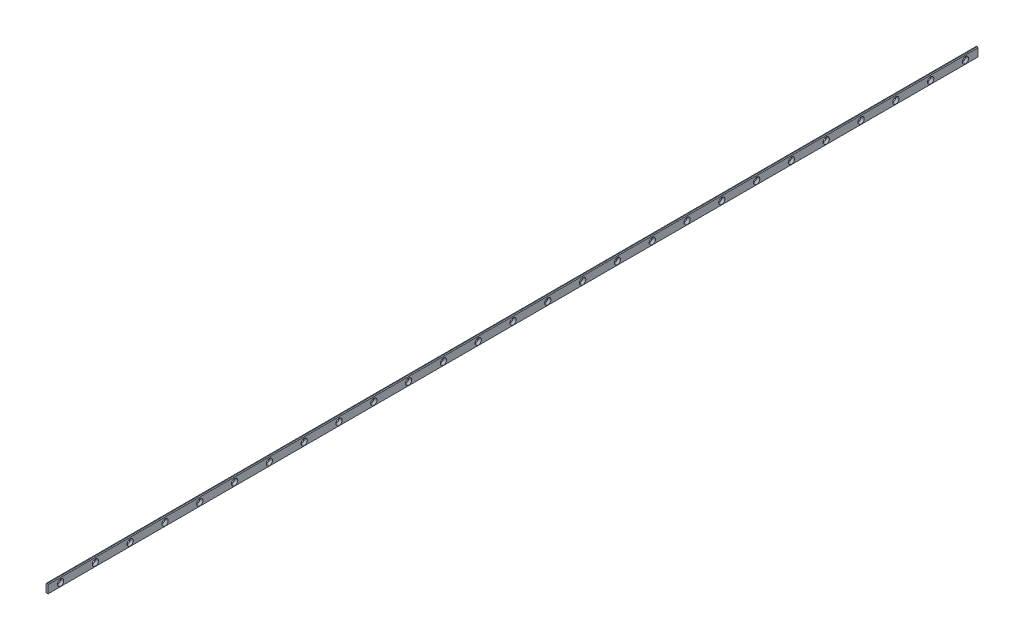
from build123d import *

# Parameters (mm, degrees)
SKETCH1_W                      = 3
SKETCH1_H                      = 12.5
BOSS_EXTRUDE1_DEPTH            = 668
SKETCH2_R                      = 2
CUT_EXTRUDE1_DEPTH             = 10
CHAMFER1_SIZE                  = 2.5
LPATTERN1_COUNT                = 14
LPATTERN1_PITCH                = 50
CHAMFER1_OF_LPATTERN1_SIZE     = 2.5
LPATTERN1_COL_COUNT            = 14
LPATTERN1_COL_PITCH            = 50
CHAMFER1_OF_LPATTERN1_COL_SIZE = 2.5
CHAMFER2_SIZE                  = 1


with BuildPart() as part:
    # Sketch1 → Boss-Extrude1 (new, symmetric)
    with BuildSketch(Plane.XY):
        Rectangle(SKETCH1_W, SKETCH1_H)
    extrude(amount=BOSS_EXTRUDE1_DEPTH, both=True)

    # Sketch2 → Cut-Extrude1 (cut)
    with BuildSketch(Plane(origin=(1.5, 0, 0), x_dir=(0, 0, -1), z_dir=(1, 0, 0))):
        with Locations((0, -1.25)):
            Circle(SKETCH2_R)
    cut_extrude1 = extrude(amount=-CUT_EXTRUDE1_DEPTH, mode=Mode.SUBTRACT)

    # Chamfer1
    chamfer1_edges = [part.edges().sort_by_distance(p)[0] for p in [
        (1.5, -1.25, 2),
    ]]
    chamfer(chamfer1_edges, length=CHAMFER1_SIZE)

    # LPattern1: Cut-Extrude1 ×14
    with Locations(*[(0, 0, i * LPATTERN1_PITCH) for i in range(1, LPATTERN1_COUNT)]):
        add(cut_extrude1, mode=Mode.SUBTRACT)

    # Chamfer1 of LPattern1
    chamfer1_of_lpattern1_edges = [part.edges().sort_by_distance(p)[0] for p in [
        (1.5, -1.25, 52),
        (1.5, -1.25, 102),
        (1.5, -1.25, 152),
        (1.5, -1.25, 202),
        (1.5, -1.25, 252),
        (1.5, -1.25, 302),
        (1.5, -1.25, 352),
        (1.5, -1.25, 402),
        (1.5, -1.25, 452),
        (1.5, -1.25, 502),
        (1.5, -1.25, 552),
        (1.5, -1.25, 602),
        (1.5, -1.25, 652),
    ]]
    chamfer(chamfer1_of_lpattern1_edges, length=CHAMFER1_OF_LPATTERN1_SIZE)

    # LPattern1 col: Cut-Extrude1 ×14
    with Locations(*[(0, 0, -i * LPATTERN1_COL_PITCH) for i in range(1, LPATTERN1_COL_COUNT)]):
        add(cut_extrude1, mode=Mode.SUBTRACT)

    # Chamfer1 of LPattern1 col
    chamfer1_of_lpattern1_col_edges = [part.edges().sort_by_distance(p)[0] for p in [
        (1.5, -1.25, -48),
        (1.5, -1.25, -98),
        (1.5, -1.25, -148),
        (1.5, -1.25, -198),
        (1.5, -1.25, -248),
        (1.5, -1.25, -298),
        (1.5, -1.25, -348),
        (1.5, -1.25, -398),
        (1.5, -1.25, -448),
        (1.5, -1.25, -498),
        (1.5, -1.25, -548),
        (1.5, -1.25, -598),
        (1.5, -1.25, -648),
    ]]
    chamfer(chamfer1_of_lpattern1_col_edges, length=CHAMFER1_OF_LPATTERN1_COL_SIZE)

    # Chamfer2
    chamfer2_edges = [part.edges().sort_by_distance(p)[0] for p in [
        (-1.5, 6.25, 0),
        (1.5, 6.25, 0),
    ]]
    chamfer(chamfer2_edges, length=CHAMFER2_SIZE)


solid = part.part
